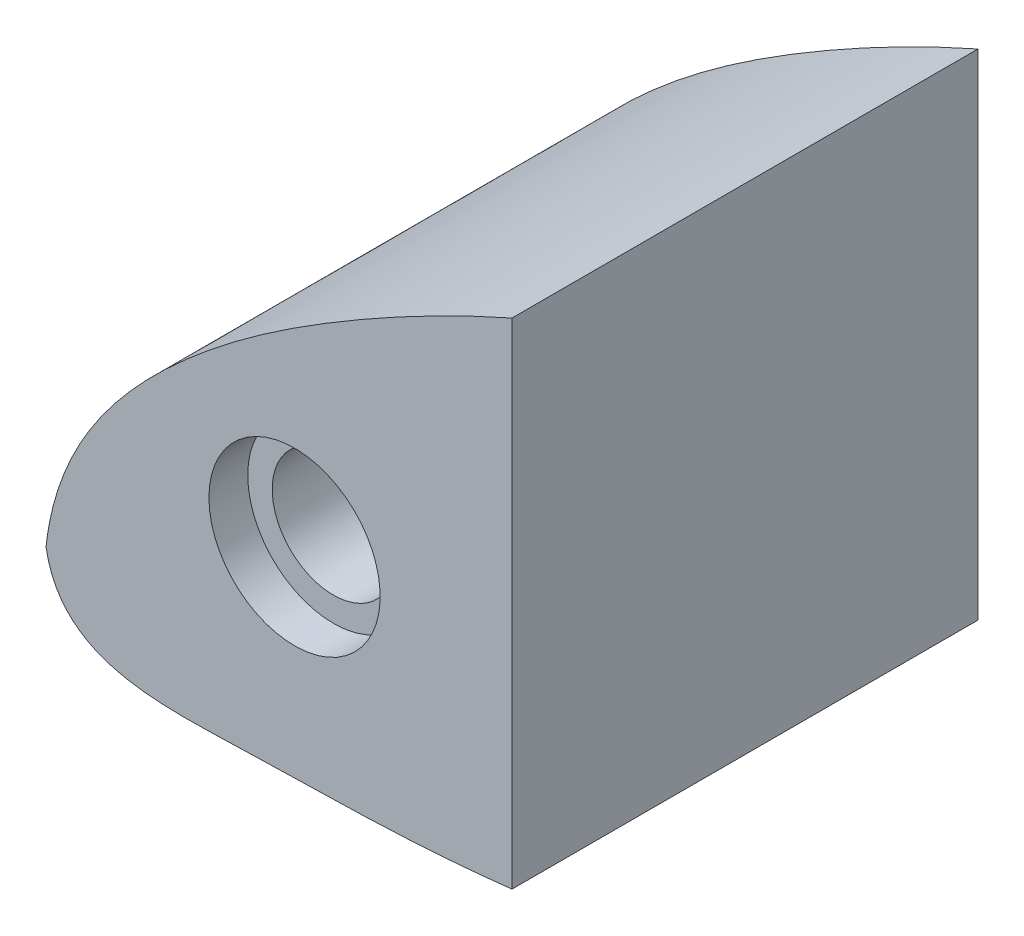
from build123d import *

# Parameters (mm, degrees)
BOSS_EXTRUDE1_DEPTH = 38.1
SKETCH2_R           = 5
SKETCH2_R_2         = 3.175
CUT_EXTRUDE1_DEPTH  = 319.018514003
SKETCH3_W           = 293.188888759
SKETCH3_H           = 137.971241769
CUT_EXTRUDE2_DEPTH  = 319.018514003
SKETCH4_R           = 7
CUT_EXTRUDE3_DEPTH  = 3.175
SKETCH5_W           = 61.216236185
SKETCH5_H           = 51.695253477
CUT_EXTRUDE4_DEPTH  = 65.391872686


with BuildPart() as part:
    # Sketch1 → Boss-Extrude1 (new body)
    with BuildSketch(Plane.XY):
        with BuildLine():
            add(Edge.make_bspline(
                [(0.000560351, 0.000130087), (0.810633127, 7.359196055), (8.649092025, 17.856605174), (26.286719818, 29.975176328), (52.111128271, 42.069215275), (89.597618475, 49.290763054), (131.400792109, 47.884831915), (173.256699242, 40.041104278), (217.961060472, 29.612974894), (256.952064401, 19.528920948), (290.35983767, 8.71099439), (301.273197721, 4.382828139), (314.816918223, -0.516206742), (309.846313895, 0.000130087)],
                knots=[0, 0, 0, 0, 0.060863618, 0.113688265, 0.188608742, 0.312908923, 0.448482434, 0.557612135, 0.691544113, 0.852438279, 0.92975597, 0.976058229, 1, 1, 1, 1], degree=3))
            add(Edge.make_bspline(
                [(309.846313895, 0.000130087), (303.956832565, 1.47095521), (293.989507544, 2.093987313), (276.26402299, 4.514356704), (260.846344817, 5.427413394), (235.858814759, 7.870306192), (205.101424636, 8.838080282), (157.718638092, 9.030650149), (110.497331172, 6.181495223), (66.506197185, -0.586669107), (36.454672816, -6.098499901), (15.316603331, -6.189065841), (1.230714189, -6.924076091), (0.000560351, 0.000130087)],
                knots=[0, 0, 0, 0, 0.057787081, 0.095274891, 0.171021118, 0.205339302, 0.335319146, 0.464904334, 0.658702312, 0.785511947, 0.893517288, 0.94309214, 1, 1, 1, 1], degree=3))
        make_face()
    boss_extrude1 = extrude(amount=BOSS_EXTRUDE1_DEPTH)

    # Sketch2 → Cut-Extrude1 (cut, through all)
    with BuildSketch(Plane.XY.offset(38.1)):
        with Locations((20.32, 10.16)):
            Circle(SKETCH2_R)
        with Locations((227.296313895, 19.050130087)):
            Circle(SKETCH2_R_2)
    cut_extrude1 = extrude(amount=-CUT_EXTRUDE1_DEPTH, mode=Mode.SUBTRACT)

    # Sketch3 → Cut-Extrude2 (cut, through all)
    with BuildSketch(Plane.XY.offset(38.1)):
        with Locations((184.69444438, 2.732377951)):
            Rectangle(SKETCH3_W, SKETCH3_H)
    cut_extrude2 = extrude(amount=-CUT_EXTRUDE2_DEPTH, mode=Mode.SUBTRACT)

    # Sketch4 → Cut-Extrude3 (cut)
    with BuildSketch(Plane(origin=(0, 0, 0), x_dir=(-1, 0, 0), z_dir=(0, 0, -1))):
        with Locations((-20.32, 10.16)):
            Circle(SKETCH4_R)
    cut_extrude3 = extrude(amount=-CUT_EXTRUDE3_DEPTH, mode=Mode.SUBTRACT)

    # Mirror1: Boss-Extrude1, Cut-Extrude1, Cut-Extrude2, Cut-Extrude3 across plane
    add(boss_extrude1.mirror(Plane(origin=(153.387816973, 8.333381989, 0), x_dir=(1, 0, 0), z_dir=(0, 0, -1))))
    add(cut_extrude1.mirror(Plane(origin=(153.387816973, 8.333381989, 0), x_dir=(1, 0, 0), z_dir=(0, 0, -1))), mode=Mode.SUBTRACT)
    add(cut_extrude2.mirror(Plane(origin=(153.387816973, 8.333381989, 0), x_dir=(1, 0, 0), z_dir=(0, 0, -1))), mode=Mode.SUBTRACT)
    add(cut_extrude3.mirror(Plane(origin=(153.387816973, 8.333381989, 0), x_dir=(1, 0, 0), z_dir=(0, 0, -1))), mode=Mode.SUBTRACT)

    # Sketch5 → Cut-Extrude4 (cut, through all)
    with BuildSketch(Plane(origin=(38.1, 0, 0), x_dir=(0, 0, -1), z_dir=(1, 0, 0))):
        with Locations((-30.608118093, 9.410506282)):
            Rectangle(SKETCH5_W, SKETCH5_H)
    extrude(amount=-CUT_EXTRUDE4_DEPTH, mode=Mode.SUBTRACT)


solid = part.part
